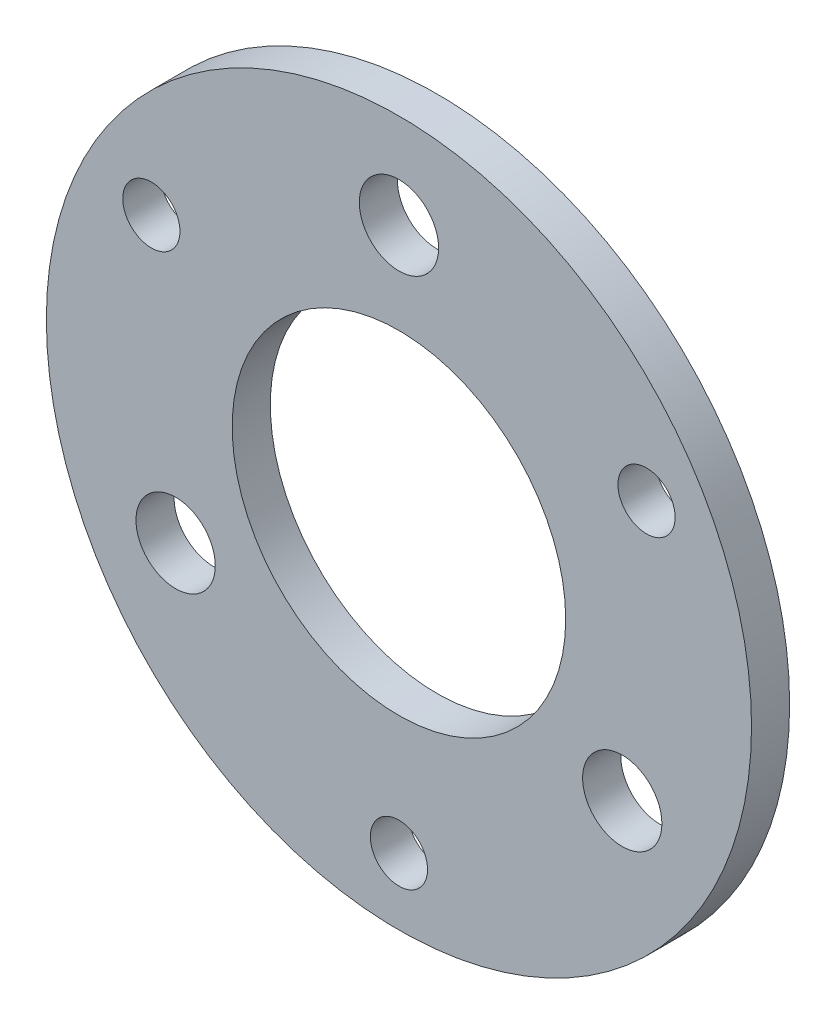
from build123d import *

# Parameters (mm, degrees)
SKETCH_1_R      = 18.5
SKETCH_1_R_2    = 2.08
SKETCH_1_R_3    = 8.75
SKETCH_1_R_4    = 1.5
EXTRUDE_1_DEPTH = 2


with BuildPart() as part:
    # 草图1 → 凸台-拉伸1 (new body)
    with BuildSketch(Plane.XY):
        with Locations((1.032176457, 0.315977943)):
            Circle(SKETCH_1_R)
        with Locations((1.032176457, 13.845977943)):
            Circle(SKETCH_1_R_2, mode=Mode.SUBTRACT)
        with Locations((12.74950017, -6.449022057)):
            Circle(SKETCH_1_R_2, mode=Mode.SUBTRACT)
        with Locations((-10.685147257, -6.449022057)):
            Circle(SKETCH_1_R_2, mode=Mode.SUBTRACT)
        with Locations((1.032176457, 0.315977943)):
            Circle(SKETCH_1_R_3, mode=Mode.SUBTRACT)
        with Locations((-11.9582046, 7.815977943)):
            Circle(SKETCH_1_R_4, mode=Mode.SUBTRACT)
        with Locations((14.022557513, 7.815977943)):
            Circle(SKETCH_1_R_4, mode=Mode.SUBTRACT)
        with Locations((1.032176457, -14.684022057)):
            Circle(SKETCH_1_R_4, mode=Mode.SUBTRACT)
    extrude(amount=EXTRUDE_1_DEPTH)


solid = part.part
